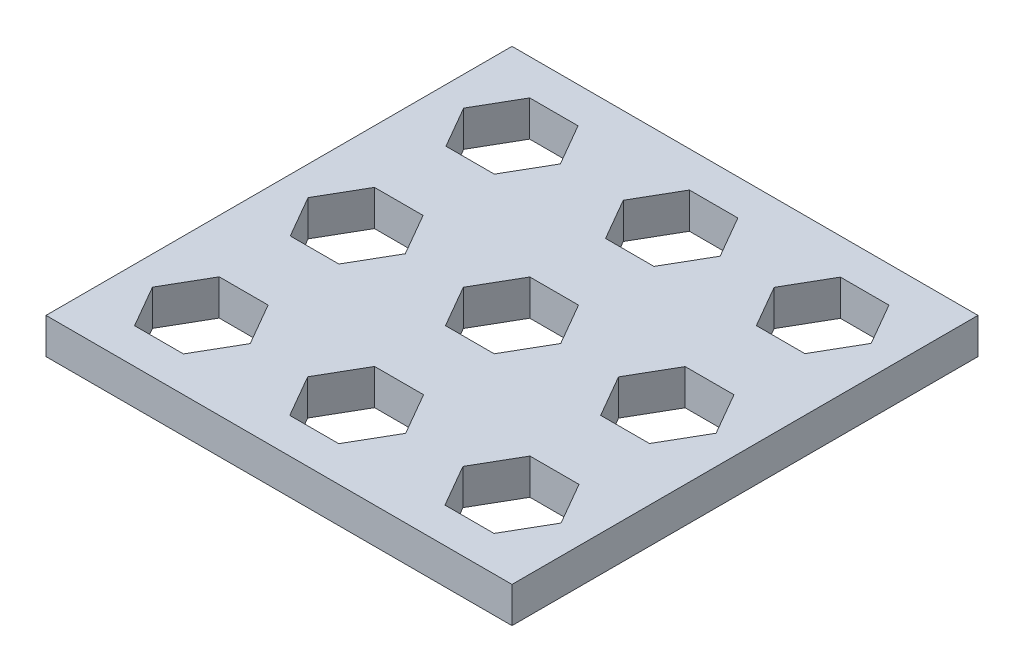
from build123d import *

# Parameters (mm, degrees)
SKETCH1_W           = 30
SKETCH1_H           = 30
BOSS_EXTRUDE1_DEPTH = 2.3
CUT_EXTRUDE3_DEPTH  = 2.3


with BuildPart() as part:
    # Sketch1 → Boss-Extrude1 (new body)
    with BuildSketch(Plane(origin=(0, 0, 0), x_dir=(1, 0, 0), z_dir=(0, 1, 0))):
        Rectangle(SKETCH1_W, SKETCH1_H)
    extrude(amount=BOSS_EXTRUDE1_DEPTH)

    # Sketch2 → Cut-Extrude3 (cut)
    with BuildSketch(Plane(origin=(0, 2.3, 0), x_dir=(1, 0, 0), z_dir=(0, 1, 0))):
        Polygon((3.135011962, 0), (1.567505981, 2.715), (-1.567505981, 2.715), (-3.135011962, 0), (-1.567505981, -2.715), (1.567505981, -2.715), align=None)
        Polygon((-6.888082049, 10), (-8.444041025, 12.695), (-11.555958975, 12.695), (-13.111917951, 10), (-11.555958975, 7.305), (-8.444041025, 7.305), align=None)
        Polygon((3.39878526, 10), (1.839939533, 12.7), (-1.277751921, 12.7), (-2.836597647, 10), (-1.277751921, 7.3), (1.839939533, 7.3), align=None)
        Polygon((13.122373208, 10), (11.56064073, 12.705), (8.437175774, 12.705), (6.875443295, 10), (8.437175774, 7.295), (11.56064073, 7.295), align=None)
        Polygon((13.139693716, 0), (11.569300984, 2.72), (8.42851552, 2.72), (6.858122787, 0), (8.42851552, -2.72), (11.569300984, -2.72), align=None)
        Polygon((13.157014224, -10), (11.577961238, -7.265), (8.419855266, -7.265), (6.840802279, -10), (8.419855266, -12.735), (11.577961238, -12.735), align=None)
        Polygon((3.15233247, -10), (1.576166235, -7.27), (-1.576166235, -7.27), (-3.15233247, -10), (-1.576166235, -12.73), (1.576166235, -12.73), align=None)
        Polygon((-6.853441033, -10), (-8.426720516, -7.275), (-11.573279484, -7.275), (-13.146558967, -10), (-11.573279484, -12.725), (-8.426720516, -12.725), align=None)
        Polygon((-6.870761541, 0), (-8.43538077, 2.71), (-11.56461923, 2.71), (-13.129238459, 0), (-11.56461923, -2.71), (-8.43538077, -2.71), align=None)
    extrude(amount=-CUT_EXTRUDE3_DEPTH, mode=Mode.SUBTRACT)


solid = part.part
